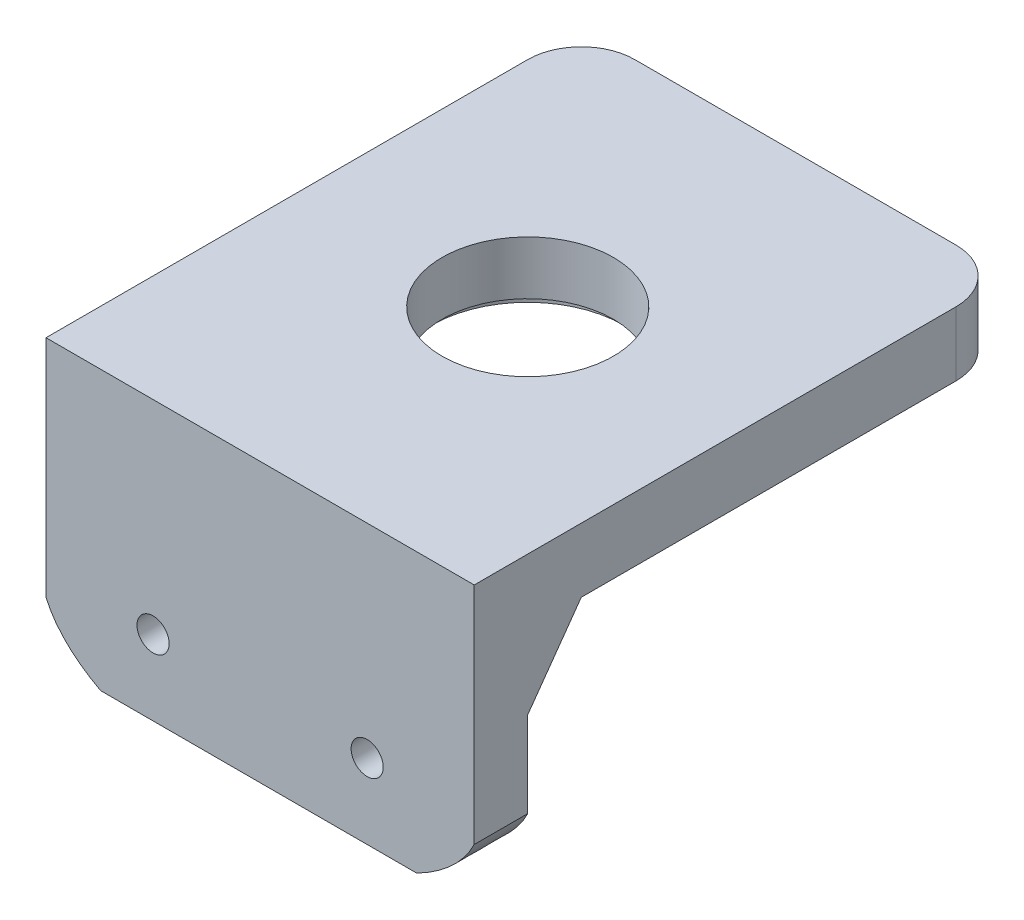
from build123d import *

# Parameters (mm, degrees)
SKETCH1_W           = 40
SKETCH1_H           = 50
BOSS_EXTRUDE1_DEPTH = 6
SKETCH3_R           = 8
CUT_EXTRUDE1_DEPTH  = 9
SKETCH4_W           = 40
SKETCH4_H           = 5
BOSS_EXTRUDE2_DEPTH = 20
BOSS_EXTRUDE3_DEPTH = 40
SKETCH6_R           = 1.5
CUT_EXTRUDE2_DEPTH  = 54.150729064
CUT_EXTRUDE3_DEPTH  = 42.243181255
CUT_EXTRUDE4_DEPTH  = 54.150729064
SKETCH9_R           = 9
CUT_EXTRUDE5_DEPTH  = 1


with BuildPart() as part:
    # Sketch1 → Boss-Extrude1 (new body)
    with BuildSketch(Plane(origin=(0, 0, 0), x_dir=(1, 0, 0), z_dir=(0, 1, 0))):
        Rectangle(SKETCH1_W, SKETCH1_H)
    extrude(amount=BOSS_EXTRUDE1_DEPTH)

    # Sketch3 → Cut-Extrude1 (cut)
    with BuildSketch(Plane(origin=(0, 6, 0), x_dir=(1, 0, 0), z_dir=(0, 1, 0))):
        with Locations(Location((0, 0, 0), (0, 0, 270))):
            Circle(SKETCH3_R)
    extrude(amount=-CUT_EXTRUDE1_DEPTH, mode=Mode.SUBTRACT)

    # Sketch4 → Boss-Extrude2 (add)
    with BuildSketch(Plane.XZ):
        with Locations((0, 22.5)):
            Rectangle(SKETCH4_W, SKETCH4_H)
    extrude(amount=BOSS_EXTRUDE2_DEPTH)

    # Sketch5 → Boss-Extrude3 (add)
    with BuildSketch(Plane(origin=(20, 0, 0), x_dir=(0, 0, -1), z_dir=(1, 0, 0))):
        Polygon((-15, 0), (-20, 0), (-20, -7), align=None)
    extrude(amount=-BOSS_EXTRUDE3_DEPTH)

    # Sketch6 → Cut-Extrude2 (cut, through all)
    with BuildSketch(Plane(origin=(0, 0, 20), x_dir=(-1, 0, 0), z_dir=(0, 0, -1))):
        with Locations((-10, -13)):
            Circle(SKETCH6_R)
        with Locations((10, -13)):
            Circle(SKETCH6_R)
    extrude(amount=-CUT_EXTRUDE2_DEPTH, mode=Mode.SUBTRACT)

    # Sketch7 → Cut-Extrude3 (cut, through all)
    with BuildSketch(Plane(origin=(0, 6, 0), x_dir=(1, 0, 0), z_dir=(0, 1, 0))):
        with BuildLine():
            Line((-20, 20), (-20, 25))
            Line((-20, 25), (-15, 25))
            ThreePointArc((-15, 25), (-18.535533906, 23.535533906), (-20, 20))
        make_face()
        with BuildLine():
            Line((15, 25), (20, 25))
            Line((20, 25), (20, 20))
            ThreePointArc((20, 20), (18.535533906, 23.535533906), (15, 25))
        make_face()
    extrude(amount=-CUT_EXTRUDE3_DEPTH, mode=Mode.SUBTRACT)

    # Sketch8 → Cut-Extrude4 (cut, through all)
    with BuildSketch(Plane(origin=(0, 0, 20), x_dir=(-1, 0, 0), z_dir=(0, 0, -1))):
        with BuildLine():
            Line((20, -20), (20, -15))
            add(Edge.make_bspline(
                [(20, -15), (19.102747752, -17.059066779), (17.286957895, -18.725733446), (14.898686187, -20)],
                knots=[0, 0, 0, 0, 0.190571824, 0.190571824, 0.190571824, 0.190571824], degree=3))
            Line((14.898686187, -20), (20, -20))
        make_face()
        with BuildLine():
            Line((-20, -20), (-14.628627564, -20))
            add(Edge.make_bspline(
                [(-14.628627564, -20), (-17.085724607, -18.725733446), (-18.991534004, -17.059066779), (-20, -15)],
                knots=[0.809428176, 0.809428176, 0.809428176, 0.809428176, 1, 1, 1, 1], degree=3))
            Line((-20, -15), (-20, -20))
        make_face()
    extrude(amount=-CUT_EXTRUDE4_DEPTH, mode=Mode.SUBTRACT)

    # Sketch9 → Cut-Extrude5 (cut)
    with BuildSketch(Plane.XZ):
        with Locations(Location((0, 0, 0), (0, 0, 270))):
            Circle(SKETCH9_R)
    extrude(amount=-CUT_EXTRUDE5_DEPTH, mode=Mode.SUBTRACT)


solid = part.part
